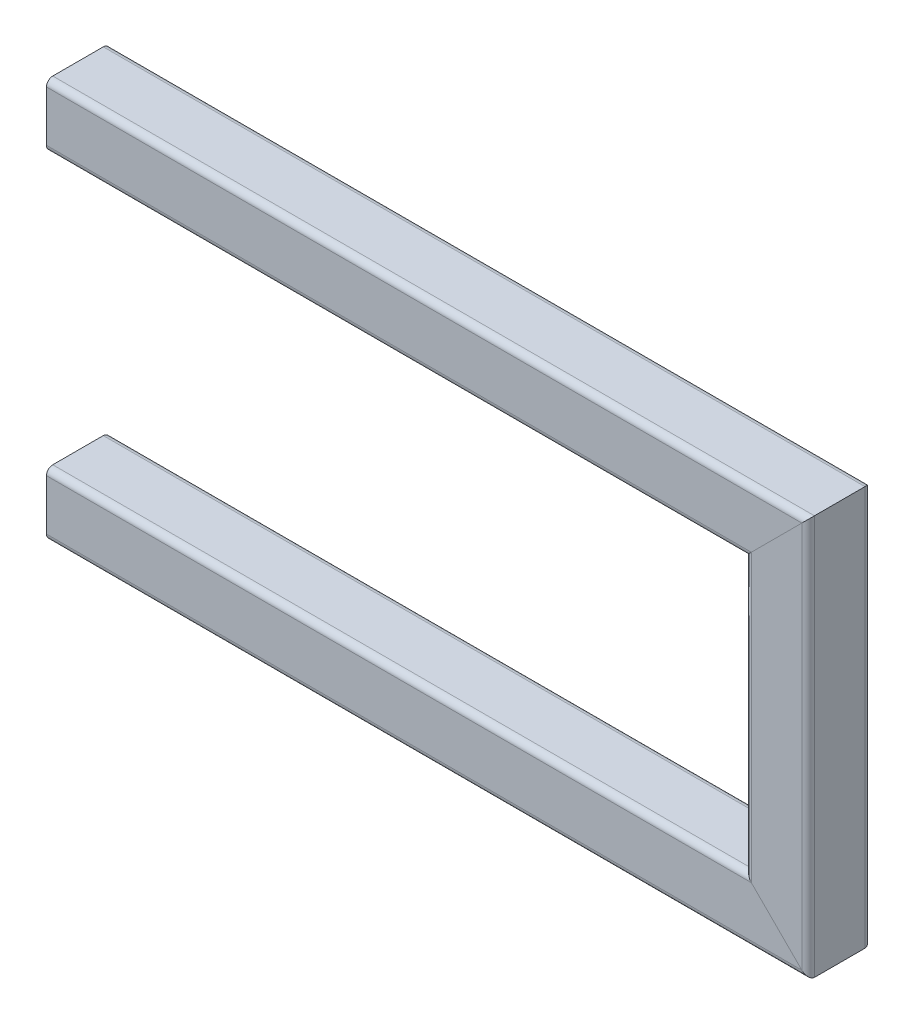
from build123d import *


with BuildPart() as part:
    # Balayage1: sweep along a path in Esquisse1
    with BuildLine(Plane.XY) as balayage1_path:
        Line((0, 0), (347, 0))
        Line((347, 0), (347, 160))
        Line((347, 160), (0, 160))
    # Esquisse2 → Balayage1 (sweep)
    with BuildSketch(Plane(origin=(0, 0, 0), x_dir=(0, 0, -1), z_dir=(1, 0, 0))):
        with BuildLine():
            Line((-12, -15), (12, -15))
            ThreePointArc((12, -15), (14.121320344, -14.121320344), (15, -12))
            Line((15, -12), (15, 12))
            ThreePointArc((15, 12), (14.121320344, 14.121320344), (12, 15))
            Line((12, 15), (-12, 15))
            ThreePointArc((-12, 15), (-14.121320344, 14.121320344), (-15, 12))
            Line((-15, 12), (-15, -12))
            ThreePointArc((-15, -12), (-14.121320344, -14.121320344), (-12, -15))
        make_face()
        with BuildLine():
            Line((-10, -13), (10, -13))
            ThreePointArc((10, -13), (12.121320344, -12.121320344), (13, -10))
            Line((13, -10), (13, 10))
            ThreePointArc((13, 10), (12.121320344, 12.121320344), (10, 13))
            Line((10, 13), (-10, 13))
            ThreePointArc((-10, 13), (-12.121320344, 12.121320344), (-13, 10))
            Line((-13, 10), (-13, -10))
            ThreePointArc((-13, -10), (-12.121320344, -12.121320344), (-10, -13))
        make_face(mode=Mode.SUBTRACT)
    sweep(path=balayage1_path.line, transition=Transition.RIGHT)


solid = part.part
